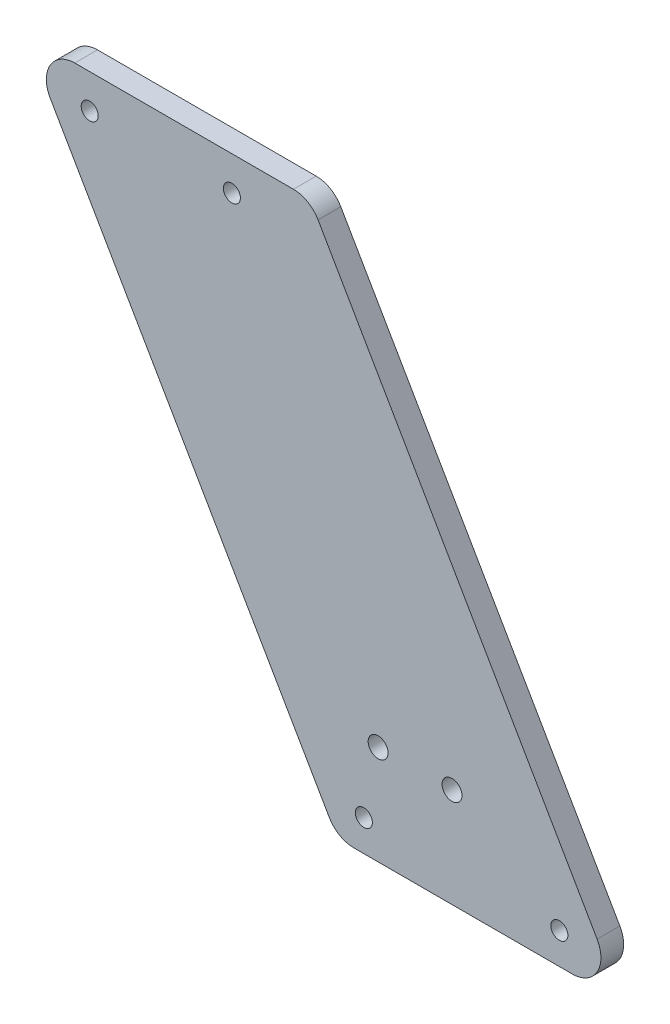
from build123d import *

# Parameters (mm, degrees)
BOSS_EXTRU_1_DEPTH      = 8
ESQUISSE2_R             = 3
ESQUISSE2_R_2           = 3.5
ENL_V_MAT_EXTRU_1_DEPTH = 644.25917494


with BuildPart() as part:
    # Esquisse1 → Boss.-Extru.1 (new body)
    with BuildSketch(Plane.XY):
        with BuildLine():
            Line((-38.452994616, 0), (38.452994616, 0))
            ThreePointArc((38.452994616, 0), (43.452994616, -1.339745962), (47.113248654, -5))
            Line((47.113248654, -5), (145.262794416, -175))
            ThreePointArc((145.262794416, -175), (145.262794416, -185), (136.602540378, -190))
            Line((136.602540378, -190), (59.696551146, -190))
            ThreePointArc((59.696551146, -190), (54.696551146, -188.660254038), (51.036297108, -185))
            Line((51.036297108, -185), (-47.113248654, -15))
            ThreePointArc((-47.113248654, -15), (-47.113248654, -5), (-38.452994616, 0))
        make_face()
    extrude(amount=BOSS_EXTRU_1_DEPTH)

    # Esquisse2 → Enlèv. mat.-Extru.1 (cut, through all)
    with BuildSketch(Plane(origin=(81.232648941, -630, 8), x_dir=(1, 0, 0), z_dir=(0, 0, 1))):
        with Locations((-114.42794679, 618)):
            Circle(ESQUISSE2_R)
        with Locations((-64.42794679, 618)):
            Circle(ESQUISSE2_R)
        with Locations((-13, 474.932525236)):
            Circle(ESQUISSE2_R_2)
        with Locations((13, 474.932525236)):
            Circle(ESQUISSE2_R_2)
        with Locations((-18.010451836, 451)):
            Circle(ESQUISSE2_R)
        with Locations((50.751089284, 451)):
            Circle(ESQUISSE2_R)
    extrude(amount=-ENL_V_MAT_EXTRU_1_DEPTH, mode=Mode.SUBTRACT)


solid = part.part
